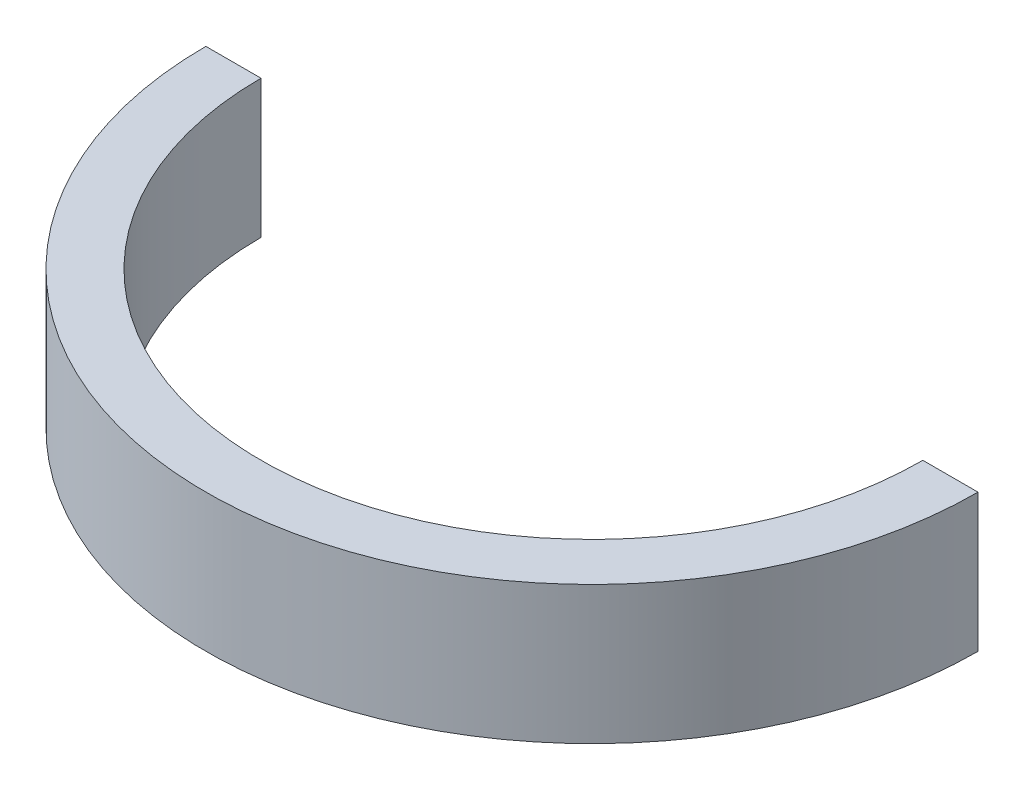
from build123d import *

# Parameters (mm, degrees)
EXTRUDE_1_DEPTH = 20


with BuildPart() as part:
    # 草图1 → 凸台-拉伸1 (new body)
    with BuildSketch(Plane(origin=(0, 0, 0), x_dir=(1, 0, 0), z_dir=(0, 1, 0))):
        with BuildLine():
            Line((-56, 0), (-48, 0))
            ThreePointArc((-48, 0), (0, -48), (48, 0))
            Line((48, 0), (56, 0))
            ThreePointArc((56, 0), (0, -56), (-56, 0))
        make_face()
    extrude(amount=EXTRUDE_1_DEPTH)


solid = part.part
